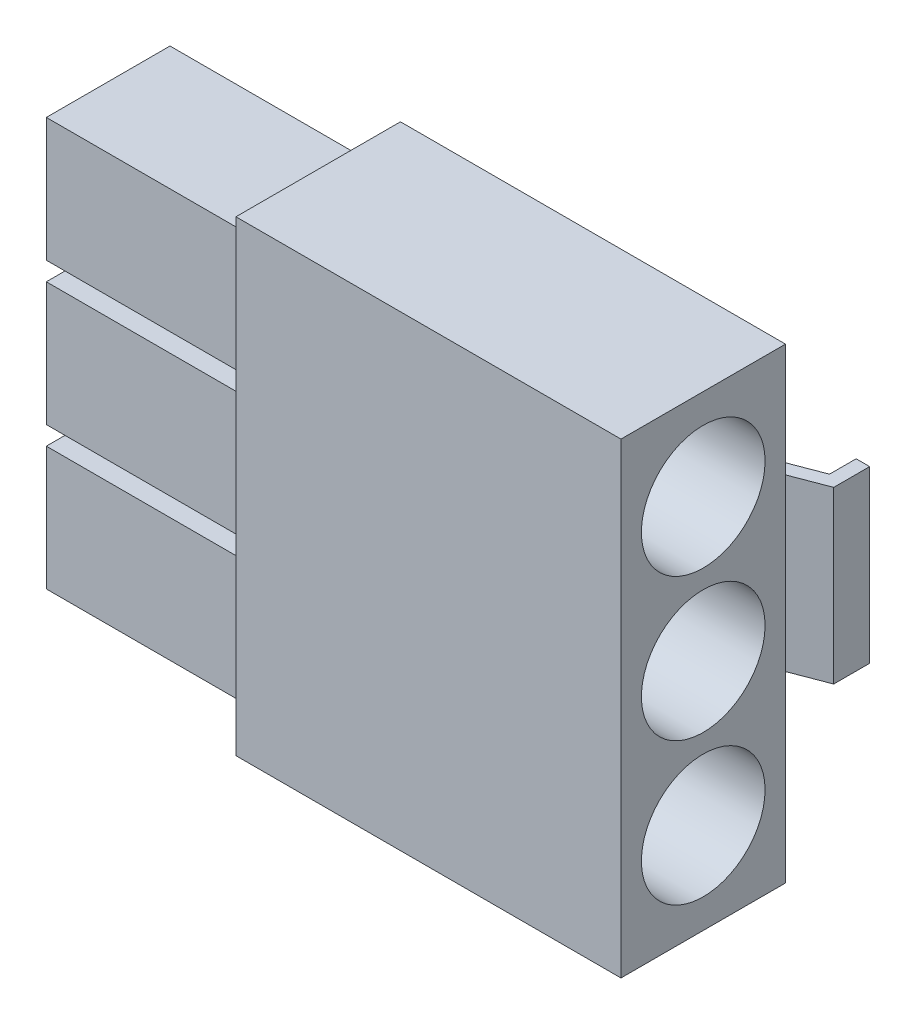
from build123d import *

# Parameters (mm, degrees)
SKETCH_1_W           = 16.5
SKETCH_1_H           = 20
EXTRUDE_1_DEPTH      = 7.05
SKETCH_2_W           = 5.3
SKETCH_2_H           = 5.3
EXTRUDE_2_DEPTH      = 9
SKETCH_3_R           = 1.8
CUT_EXTRUDE_1_DEPTH  = 26
SKETCH_4_R           = 2.65
CUT_EXTRUDE_4_DEPTH  = 16
EXTRUDE_3_DEPTH      = 3.65
EXTRUDE_3_DEPTH_BACK = 3.65
EXTRUDE_4_DEPTH      = 1.5
EXTRUDE_4_DEPTH_BACK = 1.5


with BuildPart() as part:
    # 草图1 → 凸台-拉伸1 (new body)
    with BuildSketch(Plane.XY):
        Rectangle(SKETCH_1_W, SKETCH_1_H)
    extrude(amount=EXTRUDE_1_DEPTH)

    # 草图2 → 凸台-拉伸2 (add)
    with BuildSketch(Plane.ZY.offset(8.25)):
        with Locations((3.525, 6.1)):
            Rectangle(SKETCH_2_W, SKETCH_2_H)
        with Locations((3.525, 0)):
            Rectangle(SKETCH_2_W, SKETCH_2_H)
        with Locations((3.525, -6.1)):
            Rectangle(SKETCH_2_W, SKETCH_2_H)
    extrude(amount=EXTRUDE_2_DEPTH)

    # 草图3 → 切除-拉伸1 (cut)
    with BuildSketch(Plane(origin=(8.25, 0, 0), x_dir=(0, 0, -1), z_dir=(1, 0, 0))):
        with Locations((-3.525, 0)):
            Circle(SKETCH_3_R)
        with Locations((-3.525, 6.1)):
            Circle(SKETCH_3_R)
        with Locations((-3.525, -6.1)):
            Circle(SKETCH_3_R)
    extrude(amount=-CUT_EXTRUDE_1_DEPTH, mode=Mode.SUBTRACT)

    # 草图4 → 切除-拉伸4 (cut)
    with BuildSketch(Plane(origin=(8.25, 0, 0), x_dir=(0, 0, -1), z_dir=(1, 0, 0))):
        with Locations((-3.525, 0)):
            Circle(SKETCH_4_R)
        with Locations((-3.525, 6.1)):
            Circle(SKETCH_4_R)
        with Locations((-3.525, -6.1)):
            Circle(SKETCH_4_R)
    extrude(amount=-CUT_EXTRUDE_4_DEPTH, mode=Mode.SUBTRACT)

    # 草图6 → 凸台-拉伸3 (add, two sides: drawn at the far end of the back side and taken through both)
    with BuildSketch(Plane(origin=(0, 0, 0), x_dir=(1, 0, 0), z_dir=(0, 1, 0)).offset(-EXTRUDE_3_DEPTH_BACK)):
        Polygon((-3.205949892, 0.834716435), (5.020511508, 0.834716435), (8.25, 2.067145109), (8.25, 3.607680952), (7.67, 3.607680952), (7.67, 3.027680952), (7.67, 2.466605373), (4.91360258, 1.414716435), (-3.205949892, 1.414716435), (-4.00702853, 1.414716435), (-4.00702853, 0), (-3.205949892, 0), align=None)
    extrude(amount=EXTRUDE_3_DEPTH + EXTRUDE_3_DEPTH_BACK)

    # 草图7 → 凸台-拉伸4 (add, two sides: drawn at the far end of the back side and taken through both)
    with BuildSketch(Plane(origin=(0, 0, 0), x_dir=(1, 0, 0), z_dir=(0, 1, 0)).offset(-EXTRUDE_4_DEPTH_BACK)):
        Polygon((6.29180129, 1.940660904), (-11.289383921, 1.940660904), (-11.289383921, 1.03130852), (-10.541709173, -0.037580686), (-10.541709173, 1.03130852), (-4.00702853, 1.03130852), (-4.00702853, 1.414716435), (4.91360258, 1.414716435), align=None)
    extrude(amount=EXTRUDE_4_DEPTH + EXTRUDE_4_DEPTH_BACK)


solid = part.part
